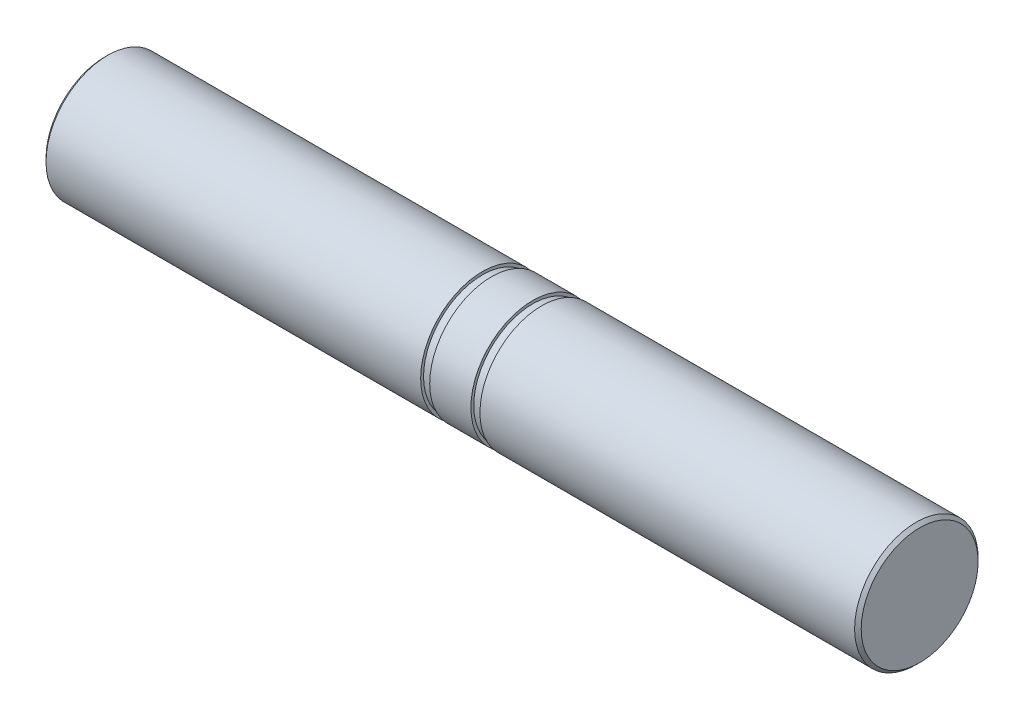
from build123d import *

# Parameters (mm, degrees)
SKETCH1_R           = 7.5
BOSS_EXTRUDE1_DEPTH = 49.5
CHAMFER1_SIZE       = 0.4
SKETCH2_W           = 1.1
SKETCH2_H           = 0.35


with BuildPart() as part:
    # Sketch1 → Boss-Extrude1 (new, symmetric)
    with BuildSketch(Plane(origin=(0, 0, 0), x_dir=(0, 0, -1), z_dir=(1, 0, 0))):
        Circle(SKETCH1_R)
    extrude(amount=BOSS_EXTRUDE1_DEPTH, both=True)

    # Chamfer1
    chamfer1_edges = [part.edges().sort_by_distance(p)[0] for p in [
        (-49.5, 0, 7.5),
        (49.5, 0, 7.5),
    ]]
    chamfer(chamfer1_edges, length=CHAMFER1_SIZE)

    # Sketch2 → Cut-Revolve1 (revolve, cut)
    with BuildSketch(Plane.XY, mode=Mode.PRIVATE) as cut_revolve1_sk:
        with Locations((-3.05, 7.325)):
            Rectangle(SKETCH2_W, SKETCH2_H)
        with Locations((3.05, 7.325)):
            Rectangle(SKETCH2_W, SKETCH2_H)
    revolve(cut_revolve1_sk.sketch.rotate(Axis((0, 0, 0), (-1, 0, 0)), 90), axis=Axis((0, 0, 0), (-1, 0, 0)), mode=Mode.SUBTRACT)


solid = part.part
